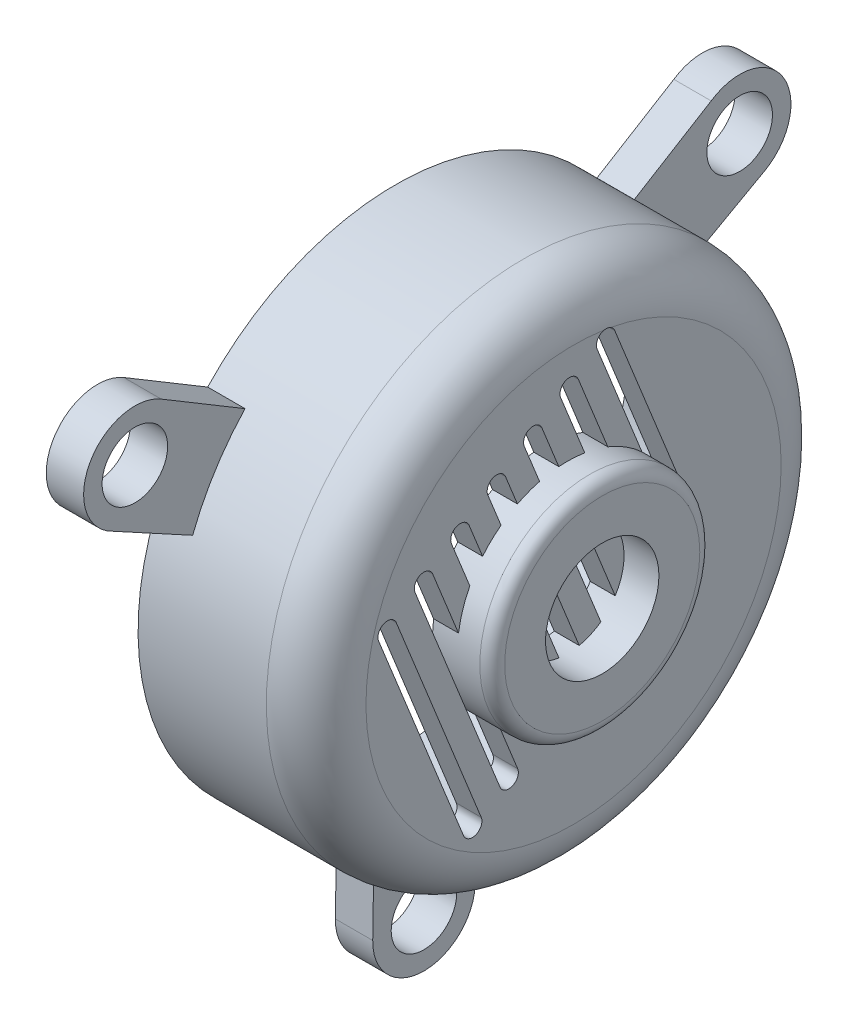
from build123d import *

# Parameters (mm, degrees)
SKETCH1_R                = 52.508103221
BOSS_EXTRUDE1_DEPTH      = 36.322
FILLET1_R                = 10.16
SHELL1_T                 = -5.08
CUT_EXTRUDE1_DEPTH       = 8.89
LPATTERN1_COUNT          = 7
LPATTERN1_PITCH          = 8.89
BOSS_EXTRUDE2_DEPTH      = 7.112
BOSS_EXTRUDE2_DEPTH_BACK = 5.08
SKETCH6_R                = 22.438749527
SKETCH6_R_2              = 11.562158197
FILLET2_R                = 2.54
SKETCH7_R                = 6.688781748
BOSS_EXTRUDE3_DEPTH      = 7.62
CIRPATTERN4_COUNT        = 3


with BuildPart() as part:
    # Sketch1 → Boss-Extrude1 (new body)
    with BuildSketch(Plane(origin=(0, 0, 0), x_dir=(0, 0, -1), z_dir=(1, 0, 0))):
        with Locations((1.26107084, 0)):
            Circle(SKETCH1_R)
    extrude(amount=BOSS_EXTRUDE1_DEPTH)

    # Fillet1
    fillet1_edges = [part.edges().sort_by_distance(p)[0] for p in [
        (36.322, 0, 51.247032381),
    ]]
    fillet(fillet1_edges, radius=FILLET1_R)

    # Shell1
    shell1_openings = [part.faces().sort_by_distance(p)[0] for p in [
        (0, 0, -1.26107084),
    ]]
    offset(amount=SHELL1_T, openings=shell1_openings, kind=Kind.INTERSECTION)

    # Sketch2 → Cut-Extrude1 (cut)
    with BuildSketch(Plane(origin=(36.322, 0, 0), x_dir=(0, 0, -1), z_dir=(1, 0, 0))):
        with BuildLine():
            Line((-34.904419589, 11.386418641), (-17.571533949, -31.67067029))
            ThreePointArc((-17.571533949, -31.67067029), (-18.64799848, -34.197771514), (-21.175099704, -33.121306983))
            Line((-21.175099704, -33.121306983), (-38.507985344, 9.935781948))
            ThreePointArc((-38.507985344, 9.935781948), (-37.431520813, 12.462883172), (-34.904419589, 11.386418641))
        make_face()
    cut_extrude1 = extrude(amount=-CUT_EXTRUDE1_DEPTH, mode=Mode.SUBTRACT)

    # LPattern1: Cut-Extrude1 ×7
    with Locations(*[Vector(0, 0.5493346615269119, -0.8356024351598751) * (i * LPATTERN1_PITCH) for i in range(1, LPATTERN1_COUNT)]):
        add(cut_extrude1, mode=Mode.SUBTRACT)

    # Sketch6 → Boss-Extrude2 (add, two sides: drawn at the far end of the back side and taken through both)
    with BuildSketch(Plane(origin=(36.322, 0, 0), x_dir=(0, 0, -1), z_dir=(1, 0, 0)).offset(-BOSS_EXTRUDE2_DEPTH_BACK)):
        Circle(SKETCH6_R)
        Circle(SKETCH6_R_2, mode=Mode.SUBTRACT)
    extrude(amount=BOSS_EXTRUDE2_DEPTH + BOSS_EXTRUDE2_DEPTH_BACK)

    # Fillet2
    fillet2_edges = [part.edges().sort_by_distance(p)[0] for p in [
        (43.434, 0, 22.438749527),
    ]]
    fillet(fillet2_edges, radius=FILLET2_R)

    # Sketch7 → Boss-Extrude3 (add)
    with BuildSketch(Plane.ZY):
        with BuildLine():
            Line((-68.934787108, 24.910674724), (-51.515117818, 15.21945026))
            Line((-51.515117818, 15.21945026), (-42.107991595, 32.994392988))
            Line((-42.107991595, 32.994392988), (-58.035685788, 42.734194788))
            ThreePointArc((-58.035685788, 42.734194788), (-72.771352602, 39.50090458), (-68.934787108, 24.910674724))
        make_face()
        with Locations((-63.852046762, 34.04673965)):
            Circle(SKETCH7_R, mode=Mode.SUBTRACT)
    boss_extrude3 = extrude(amount=-BOSS_EXTRUDE3_DEPTH)

    # CirPattern4: Boss-Extrude3 ×3 about axis
    cirpattern4_axis = Axis((0, 0, -1.26107084), (1, 0, 0))
    for i in range(1, CIRPATTERN4_COUNT):
        add(boss_extrude3.rotate(cirpattern4_axis, i * 360 / CIRPATTERN4_COUNT))


solid = part.part
